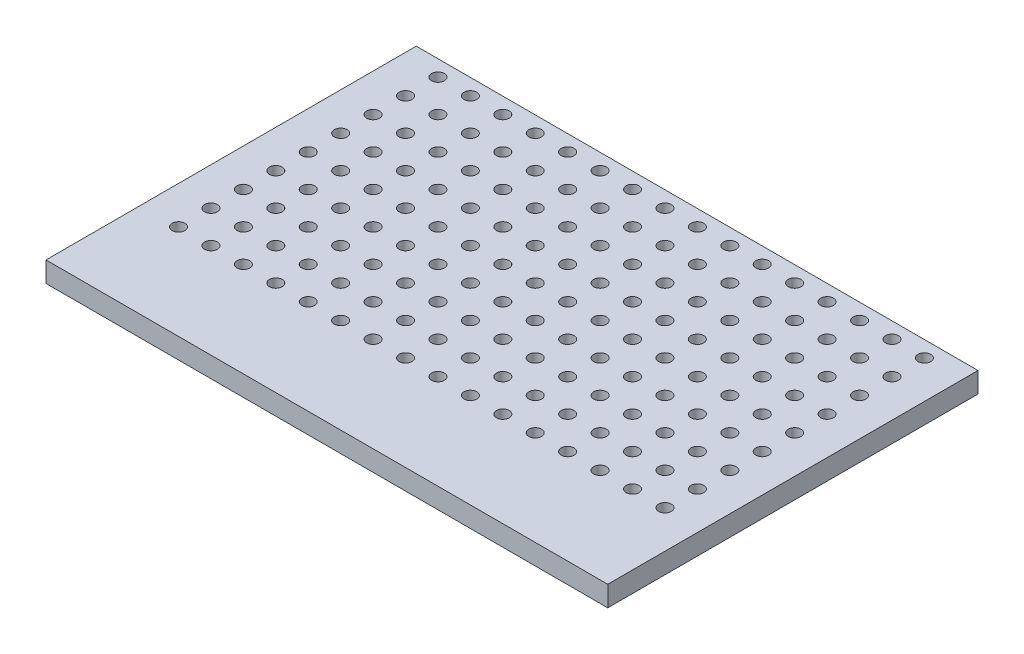
from build123d import *

# Parameters (mm, degrees)
SKETCH1_W           = 44
SKETCH1_H           = 29
SKETCH1_R           = 0.5
BOSS_EXTRUDE1_DEPTH = 1.6


with BuildPart() as part:
    # Sketch1 → Boss-Extrude1 (new body)
    with BuildSketch(Plane(origin=(0, 0, 0), x_dir=(1, 0, 0), z_dir=(0, 1, 0))):
        Rectangle(SKETCH1_W, SKETCH1_H)
        with Locations(Location((1.27, 13.25, 0), (0, 0, 270))):
            Circle(SKETCH1_R, mode=Mode.SUBTRACT)
        with Locations(Location((3.81, 13.25, 0), (0, 0, 270))):
            Circle(SKETCH1_R, mode=Mode.SUBTRACT)
        with Locations(Location((6.35, 13.25, 0), (0, 0, 270))):
            Circle(SKETCH1_R, mode=Mode.SUBTRACT)
        with Locations(Location((8.89, 13.25, 0), (0, 0, 270))):
            Circle(SKETCH1_R, mode=Mode.SUBTRACT)
        with Locations(Location((11.43, 13.25, 0), (0, 0, 270))):
            Circle(SKETCH1_R, mode=Mode.SUBTRACT)
        with Locations(Location((13.97, 13.25, 0), (0, 0, 270))):
            Circle(SKETCH1_R, mode=Mode.SUBTRACT)
        with Locations(Location((16.51, 13.25, 0), (0, 0, 270))):
            Circle(SKETCH1_R, mode=Mode.SUBTRACT)
        with Locations(Location((19.05, 13.25, 0), (0, 0, 270))):
            Circle(SKETCH1_R, mode=Mode.SUBTRACT)
        with Locations(Location((3.81, 10.71, 0), (0, 0, 270))):
            Circle(SKETCH1_R, mode=Mode.SUBTRACT)
        with Locations(Location((6.35, 10.71, 0), (0, 0, 270))):
            Circle(SKETCH1_R, mode=Mode.SUBTRACT)
        with Locations(Location((8.89, 10.71, 0), (0, 0, 270))):
            Circle(SKETCH1_R, mode=Mode.SUBTRACT)
        with Locations(Location((11.43, 10.71, 0), (0, 0, 270))):
            Circle(SKETCH1_R, mode=Mode.SUBTRACT)
        with Locations(Location((13.97, 10.71, 0), (0, 0, 270))):
            Circle(SKETCH1_R, mode=Mode.SUBTRACT)
        with Locations(Location((16.51, 10.71, 0), (0, 0, 270))):
            Circle(SKETCH1_R, mode=Mode.SUBTRACT)
        with Locations(Location((19.05, 10.71, 0), (0, 0, 270))):
            Circle(SKETCH1_R, mode=Mode.SUBTRACT)
        with Locations(Location((3.81, 8.17, 0), (0, 0, 270))):
            Circle(SKETCH1_R, mode=Mode.SUBTRACT)
        with Locations(Location((6.35, 8.17, 0), (0, 0, 270))):
            Circle(SKETCH1_R, mode=Mode.SUBTRACT)
        with Locations(Location((8.89, 8.17, 0), (0, 0, 270))):
            Circle(SKETCH1_R, mode=Mode.SUBTRACT)
        with Locations(Location((11.43, 8.17, 0), (0, 0, 270))):
            Circle(SKETCH1_R, mode=Mode.SUBTRACT)
        with Locations(Location((13.97, 8.17, 0), (0, 0, 270))):
            Circle(SKETCH1_R, mode=Mode.SUBTRACT)
        with Locations(Location((16.51, 8.17, 0), (0, 0, 270))):
            Circle(SKETCH1_R, mode=Mode.SUBTRACT)
        with Locations(Location((19.05, 8.17, 0), (0, 0, 270))):
            Circle(SKETCH1_R, mode=Mode.SUBTRACT)
        with Locations(Location((3.81, 5.63, 0), (0, 0, 270))):
            Circle(SKETCH1_R, mode=Mode.SUBTRACT)
        with Locations(Location((6.35, 5.63, 0), (0, 0, 270))):
            Circle(SKETCH1_R, mode=Mode.SUBTRACT)
        with Locations(Location((8.89, 5.63, 0), (0, 0, 270))):
            Circle(SKETCH1_R, mode=Mode.SUBTRACT)
        with Locations(Location((11.43, 5.63, 0), (0, 0, 270))):
            Circle(SKETCH1_R, mode=Mode.SUBTRACT)
        with Locations(Location((13.97, 5.63, 0), (0, 0, 270))):
            Circle(SKETCH1_R, mode=Mode.SUBTRACT)
        with Locations(Location((16.51, 5.63, 0), (0, 0, 270))):
            Circle(SKETCH1_R, mode=Mode.SUBTRACT)
        with Locations(Location((19.05, 5.63, 0), (0, 0, 270))):
            Circle(SKETCH1_R, mode=Mode.SUBTRACT)
        with Locations(Location((3.81, 3.09, 0), (0, 0, 270))):
            Circle(SKETCH1_R, mode=Mode.SUBTRACT)
        with Locations(Location((6.35, 3.09, 0), (0, 0, 270))):
            Circle(SKETCH1_R, mode=Mode.SUBTRACT)
        with Locations(Location((8.89, 3.09, 0), (0, 0, 270))):
            Circle(SKETCH1_R, mode=Mode.SUBTRACT)
        with Locations(Location((11.43, 3.09, 0), (0, 0, 270))):
            Circle(SKETCH1_R, mode=Mode.SUBTRACT)
        with Locations(Location((13.97, 3.09, 0), (0, 0, 270))):
            Circle(SKETCH1_R, mode=Mode.SUBTRACT)
        with Locations(Location((16.51, 3.09, 0), (0, 0, 270))):
            Circle(SKETCH1_R, mode=Mode.SUBTRACT)
        with Locations(Location((19.05, 3.09, 0), (0, 0, 270))):
            Circle(SKETCH1_R, mode=Mode.SUBTRACT)
        with Locations(Location((3.81, 0.55, 0), (0, 0, 270))):
            Circle(SKETCH1_R, mode=Mode.SUBTRACT)
        with Locations(Location((6.35, 0.55, 0), (0, 0, 270))):
            Circle(SKETCH1_R, mode=Mode.SUBTRACT)
        with Locations(Location((8.89, 0.55, 0), (0, 0, 270))):
            Circle(SKETCH1_R, mode=Mode.SUBTRACT)
        with Locations(Location((11.43, 0.55, 0), (0, 0, 270))):
            Circle(SKETCH1_R, mode=Mode.SUBTRACT)
        with Locations(Location((13.97, 0.55, 0), (0, 0, 270))):
            Circle(SKETCH1_R, mode=Mode.SUBTRACT)
        with Locations(Location((16.51, 0.55, 0), (0, 0, 270))):
            Circle(SKETCH1_R, mode=Mode.SUBTRACT)
        with Locations(Location((19.05, 0.55, 0), (0, 0, 270))):
            Circle(SKETCH1_R, mode=Mode.SUBTRACT)
        with Locations(Location((3.81, -1.99, 0), (0, 0, 270))):
            Circle(SKETCH1_R, mode=Mode.SUBTRACT)
        with Locations(Location((6.35, -1.99, 0), (0, 0, 270))):
            Circle(SKETCH1_R, mode=Mode.SUBTRACT)
        with Locations(Location((8.89, -1.99, 0), (0, 0, 270))):
            Circle(SKETCH1_R, mode=Mode.SUBTRACT)
        with Locations(Location((11.43, -1.99, 0), (0, 0, 270))):
            Circle(SKETCH1_R, mode=Mode.SUBTRACT)
        with Locations(Location((13.97, -1.99, 0), (0, 0, 270))):
            Circle(SKETCH1_R, mode=Mode.SUBTRACT)
        with Locations(Location((16.51, -1.99, 0), (0, 0, 270))):
            Circle(SKETCH1_R, mode=Mode.SUBTRACT)
        with Locations(Location((19.05, -1.99, 0), (0, 0, 270))):
            Circle(SKETCH1_R, mode=Mode.SUBTRACT)
        with Locations(Location((3.81, -4.53, 0), (0, 0, 270))):
            Circle(SKETCH1_R, mode=Mode.SUBTRACT)
        with Locations(Location((6.35, -4.53, 0), (0, 0, 270))):
            Circle(SKETCH1_R, mode=Mode.SUBTRACT)
        with Locations(Location((8.89, -4.53, 0), (0, 0, 270))):
            Circle(SKETCH1_R, mode=Mode.SUBTRACT)
        with Locations(Location((11.43, -4.53, 0), (0, 0, 270))):
            Circle(SKETCH1_R, mode=Mode.SUBTRACT)
        with Locations(Location((13.97, -4.53, 0), (0, 0, 270))):
            Circle(SKETCH1_R, mode=Mode.SUBTRACT)
        with Locations(Location((16.51, -4.53, 0), (0, 0, 270))):
            Circle(SKETCH1_R, mode=Mode.SUBTRACT)
        with Locations(Location((19.05, -4.53, 0), (0, 0, 270))):
            Circle(SKETCH1_R, mode=Mode.SUBTRACT)
        with Locations(Location((3.81, -7.07, 0), (0, 0, 270))):
            Circle(SKETCH1_R, mode=Mode.SUBTRACT)
        with Locations(Location((6.35, -7.07, 0), (0, 0, 270))):
            Circle(SKETCH1_R, mode=Mode.SUBTRACT)
        with Locations(Location((8.89, -7.07, 0), (0, 0, 270))):
            Circle(SKETCH1_R, mode=Mode.SUBTRACT)
        with Locations(Location((11.43, -7.07, 0), (0, 0, 270))):
            Circle(SKETCH1_R, mode=Mode.SUBTRACT)
        with Locations(Location((13.97, -7.07, 0), (0, 0, 270))):
            Circle(SKETCH1_R, mode=Mode.SUBTRACT)
        with Locations(Location((16.51, -7.07, 0), (0, 0, 270))):
            Circle(SKETCH1_R, mode=Mode.SUBTRACT)
        with Locations(Location((19.05, -7.07, 0), (0, 0, 270))):
            Circle(SKETCH1_R, mode=Mode.SUBTRACT)
        with Locations(Location((1.27, 10.71, 0), (0, 0, 270))):
            Circle(SKETCH1_R, mode=Mode.SUBTRACT)
        with Locations(Location((1.27, 8.17, 0), (0, 0, 270))):
            Circle(SKETCH1_R, mode=Mode.SUBTRACT)
        with Locations(Location((1.27, 5.63, 0), (0, 0, 270))):
            Circle(SKETCH1_R, mode=Mode.SUBTRACT)
        with Locations(Location((1.27, 3.09, 0), (0, 0, 270))):
            Circle(SKETCH1_R, mode=Mode.SUBTRACT)
        with Locations(Location((1.27, 0.55, 0), (0, 0, 270))):
            Circle(SKETCH1_R, mode=Mode.SUBTRACT)
        with Locations(Location((1.27, -1.99, 0), (0, 0, 270))):
            Circle(SKETCH1_R, mode=Mode.SUBTRACT)
        with Locations(Location((1.27, -4.53, 0), (0, 0, 270))):
            Circle(SKETCH1_R, mode=Mode.SUBTRACT)
        with Locations(Location((1.27, -7.07, 0), (0, 0, 270))):
            Circle(SKETCH1_R, mode=Mode.SUBTRACT)
        with Locations(Location((-1.27, -7.07, 0), (0, 0, 90))):
            Circle(SKETCH1_R, mode=Mode.SUBTRACT)
        with Locations(Location((-1.27, -4.53, 0), (0, 0, 90))):
            Circle(SKETCH1_R, mode=Mode.SUBTRACT)
        with Locations(Location((-1.27, -1.99, 0), (0, 0, 90))):
            Circle(SKETCH1_R, mode=Mode.SUBTRACT)
        with Locations(Location((-1.27, 0.55, 0), (0, 0, 90))):
            Circle(SKETCH1_R, mode=Mode.SUBTRACT)
        with Locations(Location((-1.27, 3.09, 0), (0, 0, 90))):
            Circle(SKETCH1_R, mode=Mode.SUBTRACT)
        with Locations(Location((-1.27, 5.63, 0), (0, 0, 90))):
            Circle(SKETCH1_R, mode=Mode.SUBTRACT)
        with Locations(Location((-1.27, 8.17, 0), (0, 0, 90))):
            Circle(SKETCH1_R, mode=Mode.SUBTRACT)
        with Locations(Location((-1.27, 10.71, 0), (0, 0, 90))):
            Circle(SKETCH1_R, mode=Mode.SUBTRACT)
        with Locations(Location((-19.05, -7.07, 0), (0, 0, 90))):
            Circle(SKETCH1_R, mode=Mode.SUBTRACT)
        with Locations(Location((-16.51, -7.07, 0), (0, 0, 90))):
            Circle(SKETCH1_R, mode=Mode.SUBTRACT)
        with Locations(Location((-13.97, -7.07, 0), (0, 0, 90))):
            Circle(SKETCH1_R, mode=Mode.SUBTRACT)
        with Locations(Location((-11.43, -7.07, 0), (0, 0, 90))):
            Circle(SKETCH1_R, mode=Mode.SUBTRACT)
        with Locations(Location((-8.89, -7.07, 0), (0, 0, 90))):
            Circle(SKETCH1_R, mode=Mode.SUBTRACT)
        with Locations(Location((-6.35, -7.07, 0), (0, 0, 90))):
            Circle(SKETCH1_R, mode=Mode.SUBTRACT)
        with Locations(Location((-3.81, -7.07, 0), (0, 0, 90))):
            Circle(SKETCH1_R, mode=Mode.SUBTRACT)
        with Locations(Location((-19.05, -4.53, 0), (0, 0, 90))):
            Circle(SKETCH1_R, mode=Mode.SUBTRACT)
        with Locations(Location((-16.51, -4.53, 0), (0, 0, 90))):
            Circle(SKETCH1_R, mode=Mode.SUBTRACT)
        with Locations(Location((-13.97, -4.53, 0), (0, 0, 90))):
            Circle(SKETCH1_R, mode=Mode.SUBTRACT)
        with Locations(Location((-11.43, -4.53, 0), (0, 0, 90))):
            Circle(SKETCH1_R, mode=Mode.SUBTRACT)
        with Locations(Location((-8.89, -4.53, 0), (0, 0, 90))):
            Circle(SKETCH1_R, mode=Mode.SUBTRACT)
        with Locations(Location((-6.35, -4.53, 0), (0, 0, 90))):
            Circle(SKETCH1_R, mode=Mode.SUBTRACT)
        with Locations(Location((-3.81, -4.53, 0), (0, 0, 90))):
            Circle(SKETCH1_R, mode=Mode.SUBTRACT)
        with Locations(Location((-19.05, -1.99, 0), (0, 0, 90))):
            Circle(SKETCH1_R, mode=Mode.SUBTRACT)
        with Locations(Location((-16.51, -1.99, 0), (0, 0, 90))):
            Circle(SKETCH1_R, mode=Mode.SUBTRACT)
        with Locations(Location((-13.97, -1.99, 0), (0, 0, 90))):
            Circle(SKETCH1_R, mode=Mode.SUBTRACT)
        with Locations(Location((-11.43, -1.99, 0), (0, 0, 90))):
            Circle(SKETCH1_R, mode=Mode.SUBTRACT)
        with Locations(Location((-8.89, -1.99, 0), (0, 0, 90))):
            Circle(SKETCH1_R, mode=Mode.SUBTRACT)
        with Locations(Location((-6.35, -1.99, 0), (0, 0, 90))):
            Circle(SKETCH1_R, mode=Mode.SUBTRACT)
        with Locations(Location((-3.81, -1.99, 0), (0, 0, 90))):
            Circle(SKETCH1_R, mode=Mode.SUBTRACT)
        with Locations(Location((-19.05, 0.55, 0), (0, 0, 90))):
            Circle(SKETCH1_R, mode=Mode.SUBTRACT)
        with Locations(Location((-16.51, 0.55, 0), (0, 0, 90))):
            Circle(SKETCH1_R, mode=Mode.SUBTRACT)
        with Locations(Location((-13.97, 0.55, 0), (0, 0, 90))):
            Circle(SKETCH1_R, mode=Mode.SUBTRACT)
        with Locations(Location((-11.43, 0.55, 0), (0, 0, 90))):
            Circle(SKETCH1_R, mode=Mode.SUBTRACT)
        with Locations(Location((-8.89, 0.55, 0), (0, 0, 90))):
            Circle(SKETCH1_R, mode=Mode.SUBTRACT)
        with Locations(Location((-6.35, 0.55, 0), (0, 0, 90))):
            Circle(SKETCH1_R, mode=Mode.SUBTRACT)
        with Locations(Location((-3.81, 0.55, 0), (0, 0, 90))):
            Circle(SKETCH1_R, mode=Mode.SUBTRACT)
        with Locations(Location((-19.05, 3.09, 0), (0, 0, 90))):
            Circle(SKETCH1_R, mode=Mode.SUBTRACT)
        with Locations(Location((-16.51, 3.09, 0), (0, 0, 90))):
            Circle(SKETCH1_R, mode=Mode.SUBTRACT)
        with Locations(Location((-13.97, 3.09, 0), (0, 0, 90))):
            Circle(SKETCH1_R, mode=Mode.SUBTRACT)
        with Locations(Location((-11.43, 3.09, 0), (0, 0, 90))):
            Circle(SKETCH1_R, mode=Mode.SUBTRACT)
        with Locations(Location((-8.89, 3.09, 0), (0, 0, 90))):
            Circle(SKETCH1_R, mode=Mode.SUBTRACT)
        with Locations(Location((-6.35, 3.09, 0), (0, 0, 90))):
            Circle(SKETCH1_R, mode=Mode.SUBTRACT)
        with Locations(Location((-3.81, 3.09, 0), (0, 0, 90))):
            Circle(SKETCH1_R, mode=Mode.SUBTRACT)
        with Locations(Location((-19.05, 5.63, 0), (0, 0, 90))):
            Circle(SKETCH1_R, mode=Mode.SUBTRACT)
        with Locations(Location((-16.51, 5.63, 0), (0, 0, 90))):
            Circle(SKETCH1_R, mode=Mode.SUBTRACT)
        with Locations(Location((-13.97, 5.63, 0), (0, 0, 90))):
            Circle(SKETCH1_R, mode=Mode.SUBTRACT)
        with Locations(Location((-11.43, 5.63, 0), (0, 0, 90))):
            Circle(SKETCH1_R, mode=Mode.SUBTRACT)
        with Locations(Location((-8.89, 5.63, 0), (0, 0, 90))):
            Circle(SKETCH1_R, mode=Mode.SUBTRACT)
        with Locations(Location((-6.35, 5.63, 0), (0, 0, 90))):
            Circle(SKETCH1_R, mode=Mode.SUBTRACT)
        with Locations(Location((-3.81, 5.63, 0), (0, 0, 90))):
            Circle(SKETCH1_R, mode=Mode.SUBTRACT)
        with Locations(Location((-19.05, 8.17, 0), (0, 0, 90))):
            Circle(SKETCH1_R, mode=Mode.SUBTRACT)
        with Locations(Location((-16.51, 8.17, 0), (0, 0, 90))):
            Circle(SKETCH1_R, mode=Mode.SUBTRACT)
        with Locations(Location((-13.97, 8.17, 0), (0, 0, 90))):
            Circle(SKETCH1_R, mode=Mode.SUBTRACT)
        with Locations(Location((-11.43, 8.17, 0), (0, 0, 90))):
            Circle(SKETCH1_R, mode=Mode.SUBTRACT)
        with Locations(Location((-8.89, 8.17, 0), (0, 0, 90))):
            Circle(SKETCH1_R, mode=Mode.SUBTRACT)
        with Locations(Location((-6.35, 8.17, 0), (0, 0, 90))):
            Circle(SKETCH1_R, mode=Mode.SUBTRACT)
        with Locations(Location((-3.81, 8.17, 0), (0, 0, 90))):
            Circle(SKETCH1_R, mode=Mode.SUBTRACT)
        with Locations(Location((-19.05, 10.71, 0), (0, 0, 90))):
            Circle(SKETCH1_R, mode=Mode.SUBTRACT)
        with Locations(Location((-16.51, 10.71, 0), (0, 0, 90))):
            Circle(SKETCH1_R, mode=Mode.SUBTRACT)
        with Locations(Location((-13.97, 10.71, 0), (0, 0, 90))):
            Circle(SKETCH1_R, mode=Mode.SUBTRACT)
        with Locations(Location((-11.43, 10.71, 0), (0, 0, 90))):
            Circle(SKETCH1_R, mode=Mode.SUBTRACT)
        with Locations(Location((-8.89, 10.71, 0), (0, 0, 90))):
            Circle(SKETCH1_R, mode=Mode.SUBTRACT)
        with Locations(Location((-6.35, 10.71, 0), (0, 0, 90))):
            Circle(SKETCH1_R, mode=Mode.SUBTRACT)
        with Locations(Location((-3.81, 10.71, 0), (0, 0, 90))):
            Circle(SKETCH1_R, mode=Mode.SUBTRACT)
        with Locations(Location((-19.05, 13.25, 0), (0, 0, 90))):
            Circle(SKETCH1_R, mode=Mode.SUBTRACT)
        with Locations(Location((-16.51, 13.25, 0), (0, 0, 90))):
            Circle(SKETCH1_R, mode=Mode.SUBTRACT)
        with Locations(Location((-13.97, 13.25, 0), (0, 0, 90))):
            Circle(SKETCH1_R, mode=Mode.SUBTRACT)
        with Locations(Location((-11.43, 13.25, 0), (0, 0, 90))):
            Circle(SKETCH1_R, mode=Mode.SUBTRACT)
        with Locations(Location((-8.89, 13.25, 0), (0, 0, 90))):
            Circle(SKETCH1_R, mode=Mode.SUBTRACT)
        with Locations(Location((-6.35, 13.25, 0), (0, 0, 90))):
            Circle(SKETCH1_R, mode=Mode.SUBTRACT)
        with Locations(Location((-3.81, 13.25, 0), (0, 0, 90))):
            Circle(SKETCH1_R, mode=Mode.SUBTRACT)
        with Locations(Location((-1.27, 13.25, 0), (0, 0, 90))):
            Circle(SKETCH1_R, mode=Mode.SUBTRACT)
    extrude(amount=BOSS_EXTRUDE1_DEPTH)


solid = part.part
